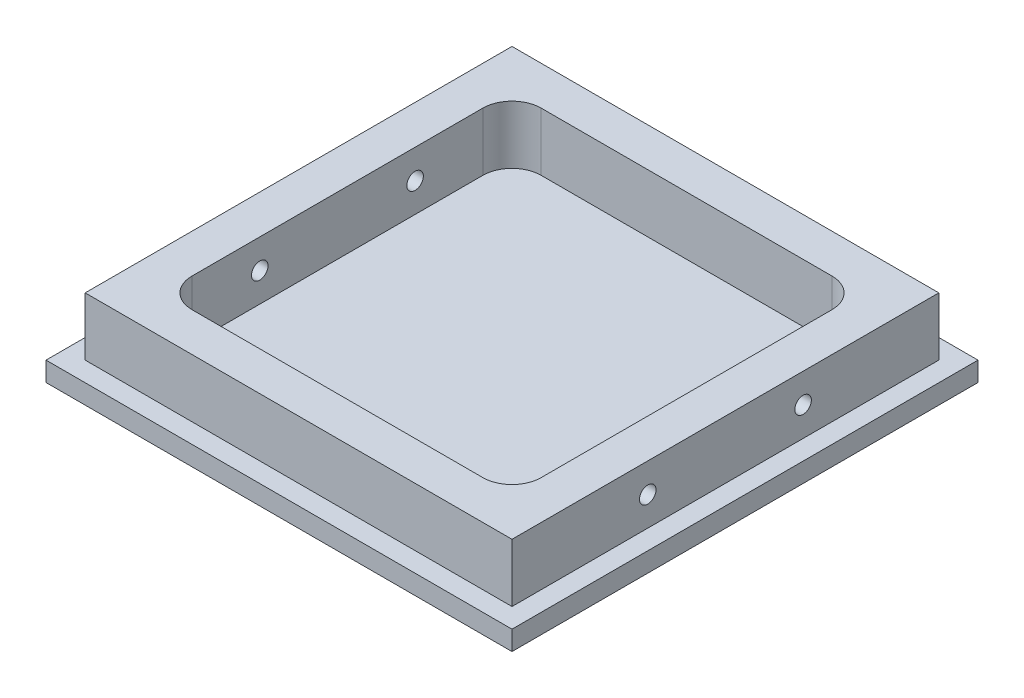
from build123d import *

# Parameters (mm, degrees)
SKETCH1_W           = 76.2
SKETCH1_H           = 76.2
BOSS_EXTRUDE1_DEPTH = 3.175
SKETCH2_W           = 69.79412
SKETCH2_H           = 69.79412
SKETCH2_W_2         = 57.09412
SKETCH2_H_2         = 57.09412
BOSS_EXTRUDE2_DEPTH = 9.525
FILLET1_R           = 4.7625


with BuildPart() as part:
    # Sketch1 → Boss-Extrude1 (new body)
    with BuildSketch(Plane(origin=(0, 0, 0), x_dir=(1, 0, 0), z_dir=(0, 1, 0))):
        Rectangle(SKETCH1_W, SKETCH1_H)
    extrude(amount=BOSS_EXTRUDE1_DEPTH)

    # Sketch2 → Boss-Extrude2 (add)
    with BuildSketch(Plane(origin=(0, 3.175, 0), x_dir=(1, 0, 0), z_dir=(0, 1, 0))):
        Rectangle(SKETCH2_W, SKETCH2_H)
        Rectangle(SKETCH2_W_2, SKETCH2_H_2, mode=Mode.SUBTRACT)
    extrude(amount=BOSS_EXTRUDE2_DEPTH)

    # Fillet1
    fillet1_edges = [part.edges().sort_by_distance(p)[0] for p in [
        (-28.54706, 7.9375, 28.54706),
        (28.54706, 7.9375, 28.54706),
        (28.54706, 7.9375, -28.54706),
        (-28.54706, 7.9375, -28.54706),
    ]]
    fillet(fillet1_edges, radius=FILLET1_R)

    # Sketch9 → #6-32 Tapped Hole2 (revolve, cut)
    with BuildSketch(Plane(origin=(34.89706, 7.9375, 12.7), x_dir=(0, 0, -1), z_dir=(0, 1, 0))):
        Polygon((0, 0), (0, 11.98869403), (1.35255, 11.176), (1.35255, 0), align=None)
    f_6_32_tapped_hole2 = revolve(axis=Axis((41.24706, 7.9375, 12.7), (-1, 0, 0)), mode=Mode.SUBTRACT)

    # Mirror1: #6-32 Tapped Hole2 across plane
    add(f_6_32_tapped_hole2.mirror(Plane.XY), mode=Mode.SUBTRACT)

    # Mirror2: #6-32 Tapped Hole2 across plane
    add(f_6_32_tapped_hole2.mirror(Plane(origin=(0, 0, 0), x_dir=(0, 0, 1), z_dir=(1, 0, 0))), mode=Mode.SUBTRACT)

    # Mirror2 copy 1 sketch → Mirror2 copy 1 (revolve, cut)
    with BuildSketch(Plane(origin=(-34.89706, 7.9375, -12.7), x_dir=(0, 0, 1), z_dir=(0, 1, 0))):
        Polygon((0, 0), (0, 11.98869403), (1.35255, 11.176), (1.35255, 0), align=None)
    revolve(axis=Axis((-41.24706, 7.9375, -12.7), (1, 0, 0)), mode=Mode.SUBTRACT)


solid = part.part
